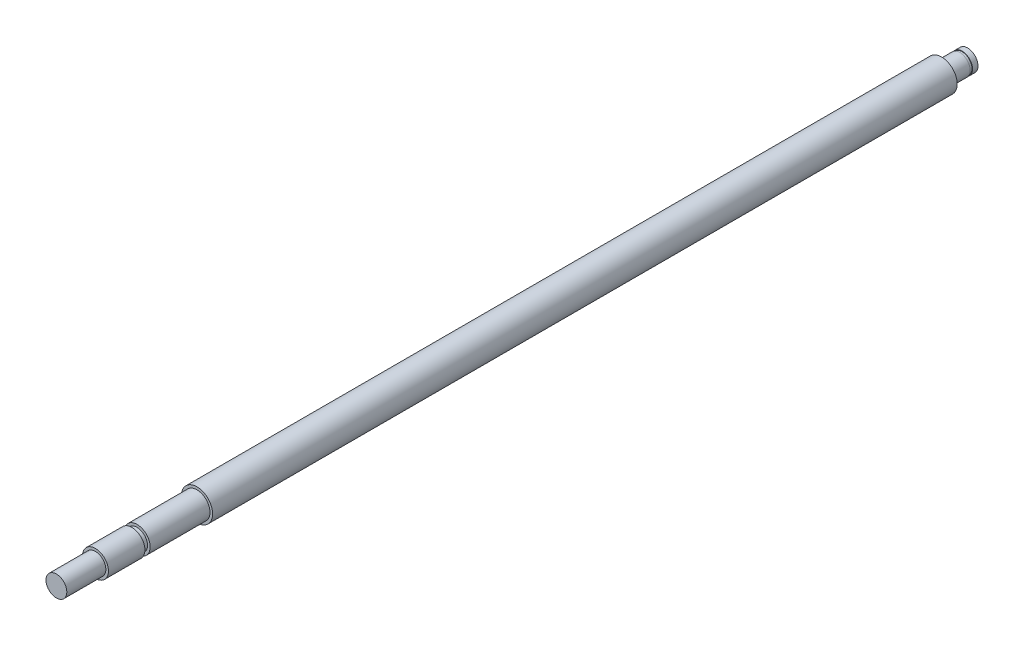
from build123d import *


with BuildPart() as part:
    # Sketch1 → Revolve1 (revolve)
    with BuildSketch(Plane(origin=(0, 0, 0), x_dir=(0, 0, -1), z_dir=(1, 0, 0)), mode=Mode.PRIVATE) as revolve1_sk:
        Polygon((-197, 0), (153, 0), (153, 4), (150.9, 4), (150.9, 3.8), (150, 3.8), (150, 4), (143, 4), (143, 6), (-143, 6), (-143, 5), (-166, 5), (-166, 4), (-168, 4), (-168, 5), (-182, 5), (-182, 4), (-197, 4), align=None)
    revolve(revolve1_sk.sketch.rotate(Axis((0, 0, 197), (0, 0, -1)), 90), axis=Axis((0, 0, 197), (0, 0, -1)))


solid = part.part
